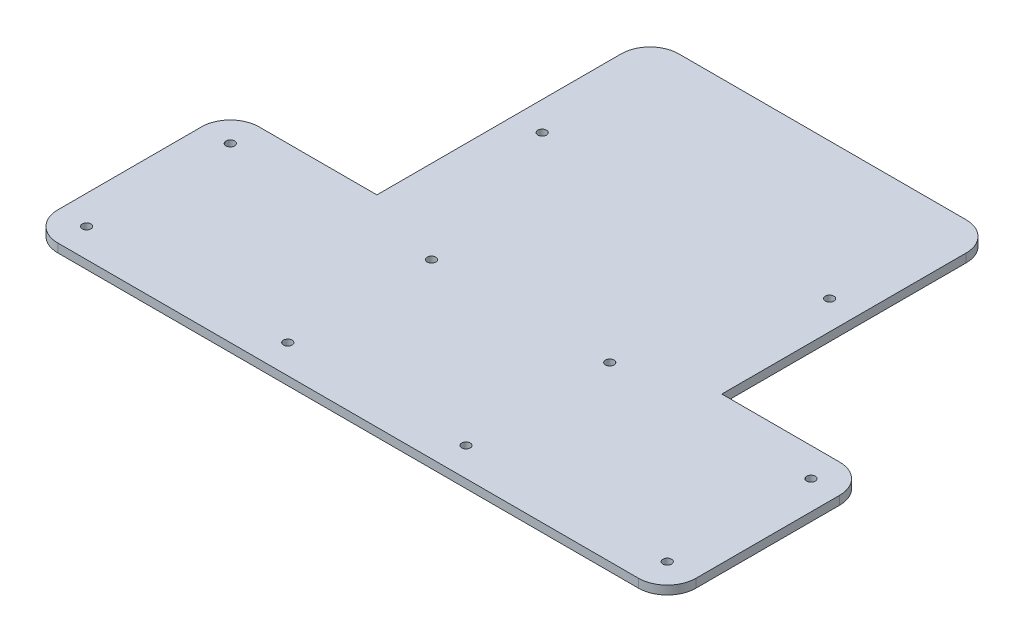
from build123d import *

# Parameters (mm, degrees)
SKETCH1_R           = 1.5
BOSS_EXTRUDE1_DEPTH = 3
FILLET1_R           = 10


with BuildPart() as part:
    # Sketch1 → Boss-Extrude1 (new body)
    with BuildSketch(Plane(origin=(0, 0, 0), x_dir=(1, 0, 0), z_dir=(0, 1, 0))):
        Polygon((-60, 130), (60, 130), (60, 35), (111, 35), (111, -35), (-111, -35), (-111, 35), (-60, 35), align=None)
        with Locations(Location((-50, 82.5, 0), (0, 0, 270))):
            Circle(SKETCH1_R, mode=Mode.SUBTRACT)
        with Locations(Location((-101, 25, 0), (0, 0, 270))):
            Circle(SKETCH1_R, mode=Mode.SUBTRACT)
        with Locations(Location((-101, -25, 0), (0, 0, 90))):
            Circle(SKETCH1_R, mode=Mode.SUBTRACT)
        with Locations(Location((-31, 25, 0), (0, 0, 270))):
            Circle(SKETCH1_R, mode=Mode.SUBTRACT)
        with Locations(Location((-31, -25, 0), (0, 0, 90))):
            Circle(SKETCH1_R, mode=Mode.SUBTRACT)
        with Locations(Location((101, 25, 0), (0, 0, 90))):
            Circle(SKETCH1_R, mode=Mode.SUBTRACT)
        with Locations(Location((101, -25, 0), (0, 0, 270))):
            Circle(SKETCH1_R, mode=Mode.SUBTRACT)
        with Locations(Location((31, -25, 0), (0, 0, 270))):
            Circle(SKETCH1_R, mode=Mode.SUBTRACT)
        with Locations(Location((31, 25, 0), (0, 0, 90))):
            Circle(SKETCH1_R, mode=Mode.SUBTRACT)
        with Locations(Location((50, 82.5, 0), (0, 0, 90))):
            Circle(SKETCH1_R, mode=Mode.SUBTRACT)
    extrude(amount=BOSS_EXTRUDE1_DEPTH)

    # Fillet1
    fillet1_edges = [part.edges().sort_by_distance(p)[0] for p in [
        (111, 1.5, -35),
        (111, 1.5, 35),
        (-111, 1.5, 35),
        (-111, 1.5, -35),
        (-60, 1.5, -130),
        (60, 1.5, -130),
    ]]
    fillet(fillet1_edges, radius=FILLET1_R)


solid = part.part
